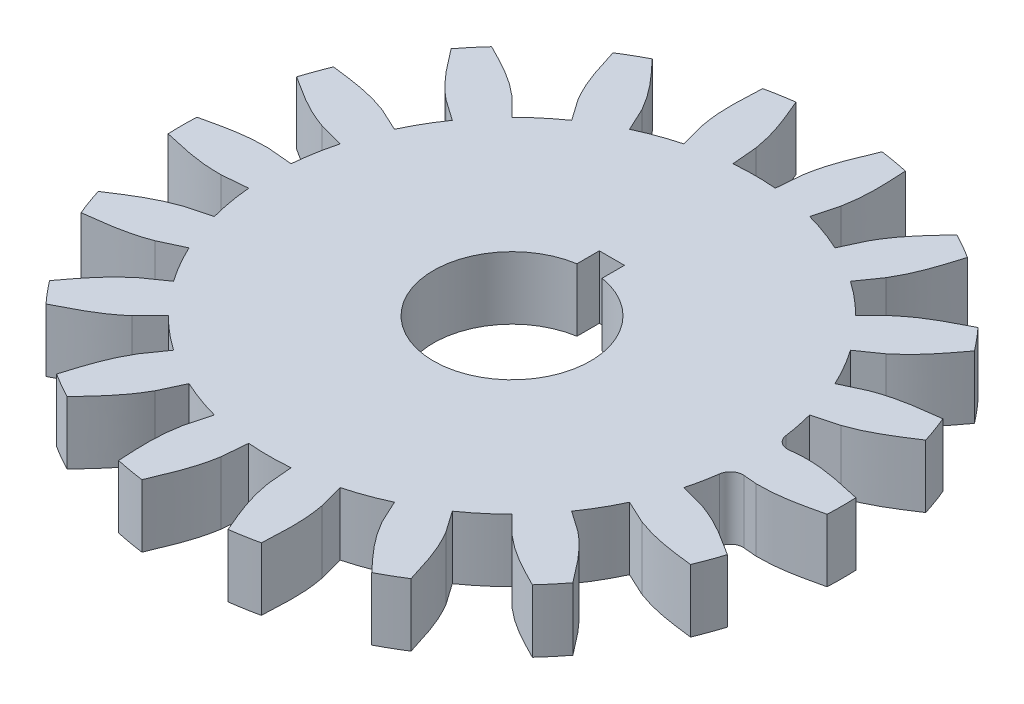
from build123d import *

# Parameters (mm, degrees)
SALIENTE_EXTRUIR1_DEPTH = 10
REDONDEO1_R             = 2
MATRIZC4_COUNT          = 18
CORTAR_EXTRUIR1_DEPTH   = 10


with BuildPart() as part:
    # Croquis1 → Saliente-Extruir1 (new body)
    with BuildSketch(Plane(origin=(0, 0, 0), x_dir=(1, 0, 0), z_dir=(0, 1, 0))):
        with BuildLine():
            Line((42.603967245, 3.727364155), (38.546070212, 3.372344167))
            ThreePointArc((38.546070212, 3.372344167), (38.362283307, 5.050490411), (38.105471616, 6.719022759))
            Line((38.105471616, 6.719022759), (0, 0))
            Line((0, 0), (38.105471616, -6.719022759))
            ThreePointArc((38.105471616, -6.719022759), (38.362283307, -5.050490411), (38.546070212, -3.372344167))
            Line((38.546070212, -3.372344167), (42.603967245, -3.727364155))
            add(Edge.make_bspline(
                [(52.462781698, -2.290574517), (46.990215725, -3.588993065), (45.193493792, -3.727364155), (42.603967245, -3.727364155)],
                knots=[0, 0, 0, 0, 1, 1, 1, 1], degree=3))
            ThreePointArc((52.462781698, -2.290574517), (52.512762212, 0), (52.462781698, 2.290574517))
            add(Edge.make_bspline(
                [(52.462781698, 2.290574517), (46.990215725, 3.588993065), (45.193493792, 3.727364155), (42.603967245, 3.727364155)],
                knots=[0, 0, 0, 0, 1, 1, 1, 1], degree=3))
        make_face()
    saliente_extruir1 = extrude(amount=SALIENTE_EXTRUIR1_DEPTH)

    # Redondeo1
    redondeo1_edges = [part.edges().sort_by_distance(p)[0] for p in [
        (38.546070212, 5, -3.372344167),
        (38.546070212, 5, 3.372344167),
    ]]
    fillet(redondeo1_edges, radius=REDONDEO1_R)

    # MatrizC4: Saliente-Extruir1 ×18 about axis
    matrizc4_axis = Axis((0, 10, 0), (0, -1, 0))
    for i in range(1, MATRIZC4_COUNT):
        add(saliente_extruir1.rotate(matrizc4_axis, i * 360 / MATRIZC4_COUNT))

    # Croquis3 → Cortar-Extruir1 (cut)
    with BuildSketch(Plane(origin=(0, 10, 0), x_dir=(1, 0, 0), z_dir=(0, 1, 0))):
        with BuildLine():
            Line((-2, 15.903074178), (-2, 12.338962679))
            ThreePointArc((-2, 12.338962679), (0, -12.5), (2, 12.338962679))
            Line((2, 12.338962679), (2, 15.903074178))
            Line((2, 15.903074178), (-2, 15.903074178))
        make_face()
    extrude(amount=-CORTAR_EXTRUIR1_DEPTH, mode=Mode.SUBTRACT)


solid = part.part
